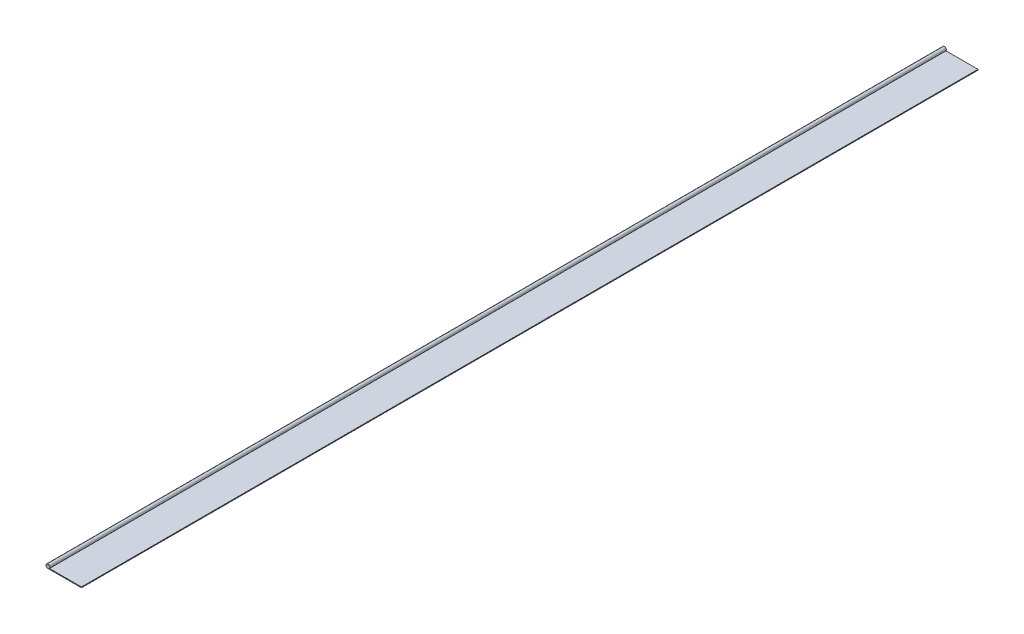
from build123d import *

# Parameters (mm, degrees)
BOSS_EXTRUDE1_DEPTH = 700


with BuildPart() as part:
    # Sketch1 → Boss-Extrude1 (new body)
    with BuildSketch(Plane.XY):
        with BuildLine():
            Line((26.2, -0.9), (1.2, -0.9))
            ThreePointArc((1.2, -0.9), (-0.670820393, 1.341640786), (0, -1.5))
            Line((0, -1.5), (26.2, -1.5))
            Line((26.2, -1.5), (26.2, -0.9))
        make_face()
    extrude(amount=BOSS_EXTRUDE1_DEPTH)


solid = part.part
